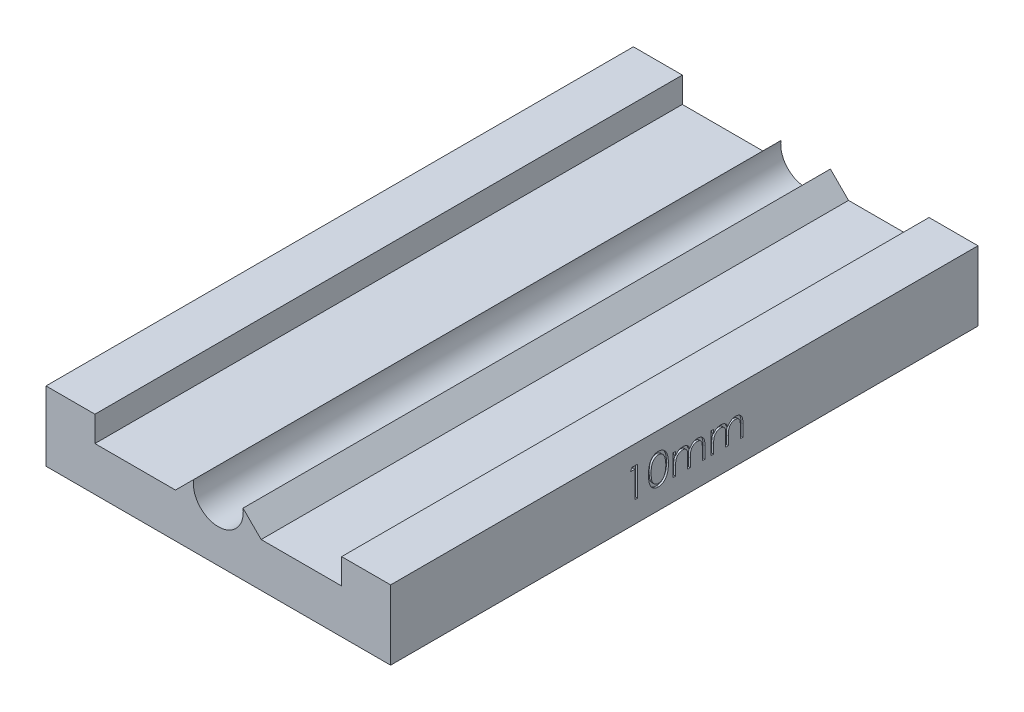
from build123d import *

# Parameters (mm, degrees)
BOSS_EXTRUDE1_DEPTH = 120
CUT_EXTRUDE1_DEPTH  = 0.4


with BuildPart() as part:
    # Sketch1 → Boss-Extrude1 (new body)
    with BuildSketch(Plane.XY):
        with BuildLine():
            ThreePointArc((5.1, 0), (-0.358834748, -5.087360575), (-5.04950495, 0.715890882))
            Line((-5.04950495, 0.715890882), (-8.752906664, -2.987510832))
            Line((-8.752906664, -2.987510832), (-25.2, -2.987510832))
            Line((-25.2, -2.987510832), (-25.2, 2.212489168))
            Line((-25.2, 2.212489168), (-35.2, 2.212489168))
            Line((-35.2, 2.212489168), (-35.2, -12))
            Line((-35.2, -12), (35.2, -12))
            Line((35.2, -12), (35.2, 2.212489168))
            Line((35.2, 2.212489168), (25.2, 2.212489168))
            Line((25.2, 2.212489168), (25.2, -2.987510832))
            Line((25.2, -2.987510832), (8.752906664, -2.987510832))
            Line((8.752906664, -2.987510832), (5.04950495, 0.715890882))
            ThreePointArc((5.04950495, 0.715890882), (5.087360575, 0.358834748), (5.1, 0))
        make_face()
    extrude(amount=BOSS_EXTRUDE1_DEPTH)

    # Sketch2 → Cut-Extrude1 (cut)
    # profile 1 of 4: a face of its own
    with BuildSketch(Plane(origin=(35.2, 0, 0), x_dir=(0, 0, -1), z_dir=(1, 0, 0))):
        Polygon((-70.660407827, -1.654928169), (-69.551032827, -1.654928169), (-69.551032827, -7.654928169), (-70.089494366, -7.654928169), (-70.089494366, -2.270312784), (-71.012571289, -2.270312784), align=None)
    # profile 2 of 4: a face of its own
    with BuildSketch(Plane(origin=(35.2, 0, 0), x_dir=(0, 0, -1), z_dir=(1, 0, 0))):
        with BuildLine():
            add(Edge.make_bspline(
                [(-67.320263596, -4.657332015), (-67.31970128, -4.561165065), (-67.318608971, -4.374359377), (-67.306457392, -4.102157134), (-67.286271091, -3.846796638), (-67.258607023, -3.608265668), (-67.224941914, -3.386502643), (-67.18000108, -3.182100202), (-67.128893419, -2.994112305), (-67.069660654, -2.821925936), (-67.002824445, -2.663221303), (-66.930079998, -2.515063815), (-66.84854035, -2.377677645), (-66.762865642, -2.248870004), (-66.669587805, -2.130749385), (-66.571361307, -2.021647678), (-66.464352376, -1.924086391), (-66.352198648, -1.835207015), (-66.233884709, -1.757293635), (-66.112782996, -1.688666084), (-65.988059957, -1.63003774), (-65.859375072, -1.58393985), (-65.727884973, -1.545864112), (-65.593130001, -1.519825916), (-65.454887663, -1.503442645), (-65.361576632, -1.501876357), (-65.314253981, -1.501082015)],
                knots=[0, 0, 0, 0, 1.646270934, 3.197905019, 4.663502075, 6.030701355, 7.308322542, 8.50163776, 9.611534131, 10.641858119, 11.616356847, 12.558055219, 13.465016945, 14.349605745, 15.204443733, 16.039544428, 16.859896111, 17.680448484, 18.487036065, 19.28249412, 20.06191084, 20.843045899, 21.620316918, 22.403196591, 23.190181807, 24, 24, 24, 24], degree=3))
            add(Edge.make_bspline(
                [(-65.314253981, -1.501082015), (-65.266536018, -1.50191827), (-65.171640003, -1.503581317), (-65.031342217, -1.519565218), (-64.894285619, -1.546087144), (-64.761054524, -1.583665957), (-64.630554548, -1.630287117), (-64.50380642, -1.688722175), (-64.380022852, -1.756743091), (-64.26117093, -1.836669737), (-64.145945875, -1.925782211), (-64.037177939, -2.026518215), (-63.93485722, -2.13786059), (-63.837699554, -2.258618071), (-63.748461387, -2.391106788), (-63.66347836, -2.533022405), (-63.587412013, -2.686846745), (-63.51415257, -2.850013261), (-63.450917736, -3.027036676), (-63.393889887, -3.216919123), (-63.347811655, -3.421903443), (-63.309430045, -3.640914149), (-63.279695938, -3.874755549), (-63.25803998, -4.122926376), (-63.246600405, -4.385589902), (-63.244446061, -4.565174787), (-63.24334052, -4.657332015)],
                knots=[0, 0, 0, 0, 0.810914788, 1.612654377, 2.396697861, 3.181598691, 3.963628158, 4.749916497, 5.551656086, 6.361998678, 7.18212741, 8.025565596, 8.878627764, 9.750805457, 10.657531673, 11.591944965, 12.560506719, 13.57287815, 14.630710178, 15.753379473, 16.941251878, 18.199788006, 19.531962791, 20.947069417, 22.433333509, 24, 24, 24, 24], degree=3))
            add(Edge.make_bspline(
                [(-63.24334052, -4.657332015), (-63.244457522, -4.749087286), (-63.246633955, -4.927868689), (-63.257911738, -5.189350361), (-63.280126534, -5.436204149), (-63.307915085, -5.669022085), (-63.34640245, -5.886835146), (-63.393725593, -6.090397058), (-63.446269003, -6.280586895), (-63.51112865, -6.455846572), (-63.582118439, -6.618620954), (-63.659355918, -6.77062178), (-63.742104192, -6.913192567), (-63.832256326, -7.045192133), (-63.928347892, -7.167555545), (-64.032435529, -7.278122898), (-64.141585104, -7.379558336), (-64.257149245, -7.469818269), (-64.377854762, -7.548820791), (-64.501213179, -7.619473106), (-64.629413265, -7.67644344), (-64.759549755, -7.725360654), (-64.893484097, -7.762732857), (-65.031049339, -7.788573752), (-65.171545743, -7.806696921), (-65.266519855, -7.808079458), (-65.314253981, -7.808774323)],
                knots=[0, 0, 0, 0, 1.561518951, 3.042555995, 4.452378317, 5.7783523, 7.031515105, 8.214008947, 9.334062868, 10.386615937, 11.391082383, 12.354592575, 13.286541444, 14.194233754, 15.072674879, 15.931287219, 16.775624067, 17.606195743, 18.42308326, 19.229000347, 20.022332153, 20.807536673, 21.593273796, 22.3848459, 23.188221202, 24, 24, 24, 24], degree=3))
            add(Edge.make_bspline(
                [(-65.314253981, -7.808774323), (-65.361575319, -7.807974856), (-65.454883762, -7.806398464), (-65.593145063, -7.79008921), (-65.727343537, -7.763868348), (-65.858141401, -7.727154169), (-65.986209713, -7.68221445), (-66.109803347, -7.623665278), (-66.230296519, -7.556235445), (-66.347367758, -7.479443294), (-66.458817177, -7.391463266), (-66.565271929, -7.294153057), (-66.664057676, -7.185084352), (-66.75600184, -7.065979341), (-66.843385991, -6.937933783), (-66.923767774, -6.799199429), (-66.998117809, -6.650326382), (-67.066078079, -6.490352821), (-67.126332931, -6.316944373), (-67.179557573, -6.12811721), (-67.221581843, -5.922204691), (-67.257552624, -5.700860633), (-67.286565852, -5.463133895), (-67.306373267, -5.208895419), (-67.318615521, -4.938303632), (-67.319704213, -4.752698304), (-67.320263596, -4.657332015)],
                knots=[0, 0, 0, 0, 0.810891512, 1.598919785, 2.382837074, 3.152667961, 3.926044502, 4.706494248, 5.493654104, 6.291793342, 7.103789334, 7.925228297, 8.761435821, 9.622817696, 10.50288917, 11.416980706, 12.369136599, 13.353924996, 14.394355917, 15.514179734, 16.714354668, 17.994756427, 19.357759367, 20.818452758, 22.365282078, 24, 24, 24, 24], degree=3))
        make_face()
        with BuildLine():
            add(Edge.make_bspline(
                [(-66.781802058, -4.654928169), (-66.781597292, -4.735068795), (-66.78119988, -4.890606015), (-66.770817822, -5.116623034), (-66.756674567, -5.327429312), (-66.738432343, -5.523292517), (-66.711341575, -5.703549682), (-66.680987081, -5.869440567), (-66.644047499, -6.020087259), (-66.600341754, -6.156523506), (-66.550560445, -6.281064766), (-66.496207536, -6.396952564), (-66.437817725, -6.505555883), (-66.37247061, -6.605899212), (-66.30130193, -6.698309779), (-66.2259192, -6.784423206), (-66.143509056, -6.861218031), (-66.02950264, -6.953321211), (-65.878994398, -7.048496869), (-65.689359332, -7.13137588), (-65.49449913, -7.183460091), (-65.362239844, -7.190083672), (-65.296225135, -7.193389707)],
                knots=[0, 0, 0, 0, 1.459021318, 2.831673884, 4.118529203, 5.306027144, 6.411944654, 7.436330062, 8.375795394, 9.233974572, 10.042671642, 10.816086306, 11.563610507, 12.285937304, 12.993564865, 13.685989202, 14.367179055, 15.041617293, 16.353048772, 17.594441528, 18.799311195, 20, 20, 20, 20], degree=3))
            add(Edge.make_bspline(
                [(-65.296225135, -7.193389707), (-65.229783412, -7.190650655), (-65.097037144, -7.185178204), (-64.903093495, -7.132380369), (-64.714813032, -7.052718301), (-64.567261134, -6.958522577), (-64.455005345, -6.86881687), (-64.37457622, -6.792334615), (-64.300755565, -6.706695986), (-64.23074058, -6.614297193), (-64.166525021, -6.513372934), (-64.108131071, -6.404408519), (-64.054845332, -6.287101357), (-64.024486968, -6.205210376), (-64.00896552, -6.16334163)],
                knots=[0, 0, 0, 0, 1.353760809, 2.704726607, 4.075137775, 5.516104923, 6.260822281, 7.007110065, 7.778089737, 8.566572457, 9.372053459, 10.217411131, 11.088608312, 12, 12, 12, 12], degree=3))
            add(Edge.make_bspline(
                [(-64.00896552, -6.16334163), (-63.990876775, -6.109804934), (-63.954148865, -6.001102481), (-63.906814395, -5.832479078), (-63.869536568, -5.655560054), (-63.835999369, -5.471402711), (-63.813108417, -5.278648938), (-63.794683594, -5.077895137), (-63.783830988, -4.868989944), (-63.7824857, -4.727055674), (-63.781802058, -4.654928169)],
                knots=[0, 0, 0, 0, 0.884706709, 1.796334032, 2.740027952, 3.714592787, 4.726048262, 5.777819803, 6.87074269, 8, 8, 8, 8], degree=3))
            add(Edge.make_bspline(
                [(-63.781802058, -4.654928169), (-63.78274524, -4.58281233), (-63.784590304, -4.441738334), (-63.791642855, -4.235135738), (-63.809854697, -4.038905291), (-63.830081757, -3.852201623), (-63.859905565, -3.676058247), (-63.892061805, -3.509000581), (-63.935263884, -3.353098253), (-63.981412069, -3.205910399), (-64.03422989, -3.069109277), (-64.092371149, -2.942057071), (-64.154465593, -2.8241404), (-64.221909433, -2.715682786), (-64.293902033, -2.616198427), (-64.372343546, -2.527681979), (-64.454122471, -2.447390034), (-64.568666218, -2.355739915), (-64.718622143, -2.262291294), (-64.905214681, -2.176292849), (-65.099392929, -2.126907205), (-65.230661707, -2.119944312), (-65.296225135, -2.11646663)],
                knots=[0, 0, 0, 0, 1.31362396, 2.569729283, 3.763502607, 4.902122613, 5.988968491, 7.01645872, 7.998833611, 8.933434873, 9.825090667, 10.667526885, 11.477055099, 12.250526234, 12.991942729, 13.710640831, 14.402115721, 15.076753259, 16.378508321, 17.609869233, 18.806226677, 20, 20, 20, 20], degree=3))
            add(Edge.make_bspline(
                [(-65.296225135, -2.11646663), (-65.36258615, -2.11994911), (-65.495429074, -2.126920415), (-65.691625568, -2.176108849), (-65.87969017, -2.261845362), (-66.029249556, -2.356049429), (-66.14387319, -2.445772249), (-66.224586378, -2.523577599), (-66.300265531, -2.608685463), (-66.369981588, -2.701945889), (-66.435277502, -2.802172233), (-66.495244952, -2.910152972), (-66.54927466, -3.026435311), (-66.599133865, -3.150920629), (-66.64297293, -3.287345105), (-66.67913401, -3.437806237), (-66.712540387, -3.60316948), (-66.736189419, -3.784402922), (-66.757213001, -3.980315185), (-66.770723883, -4.191647731), (-66.78123461, -4.418043811), (-66.78160912, -4.574385226), (-66.781802058, -4.654928169)],
                knots=[0, 0, 0, 0, 1.207732386, 2.417664972, 3.655092373, 4.956220595, 5.625982001, 6.301752483, 6.994047911, 7.697131622, 8.419323945, 9.170223765, 9.943494443, 10.752040957, 11.610060368, 12.549350801, 13.567764191, 14.679664412, 15.874934091, 17.154273443, 18.533957287, 20, 20, 20, 20], degree=3))
        make_face(mode=Mode.SUBTRACT)
    # profile 3 of 4: a face of its own
    with BuildSketch(Plane(origin=(35.2, 0, 0), x_dir=(0, 0, -1), z_dir=(1, 0, 0))):
        with BuildLine():
            Line((-62.320263596, -3.270312784), (-61.781802058, -3.270312784))
            Line((-61.781802058, -3.270312784), (-61.781802058, -4.032332015))
            add(Edge.make_bspline(
                [(-61.781802058, -4.032332015), (-61.733315287, -3.965667555), (-61.640409985, -3.837932058), (-61.488068866, -3.669605857), (-61.335881245, -3.526757592), (-61.226281162, -3.451769812), (-61.173628981, -3.415745477)],
                knots=[0, 0, 0, 0, 1.134379233, 2.173579362, 3.122582517, 4, 4, 4, 4], degree=3))
            add(Edge.make_bspline(
                [(-61.173628981, -3.415745477), (-61.101860989, -3.381450565), (-60.959578875, -3.313459913), (-60.734288775, -3.244488098), (-60.50376077, -3.20210221), (-60.348089546, -3.19630557), (-60.269782827, -3.193389707)],
                knots=[0, 0, 0, 0, 1.014936303, 2.012140481, 3.000054389, 4, 4, 4, 4], degree=3))
            add(Edge.make_bspline(
                [(-60.269782827, -3.193389707), (-60.216823405, -3.195181634), (-60.112019555, -3.198727762), (-59.956732543, -3.221802108), (-59.80611778, -3.261686976), (-59.661065158, -3.317242388), (-59.524401137, -3.384522423), (-59.399105369, -3.463464779), (-59.286606726, -3.552088337), (-59.186962067, -3.654395079), (-59.097358024, -3.77325782), (-59.014937144, -3.911882246), (-58.938779637, -4.073381094), (-58.896571679, -4.190580879), (-58.874350135, -4.252283938)],
                knots=[0, 0, 0, 0, 1.009824226, 1.998387844, 2.986035974, 3.974953746, 4.955485308, 5.885931332, 6.793869504, 7.679848016, 8.601185859, 9.625726857, 10.749998409, 12, 12, 12, 12], degree=3))
            add(Edge.make_bspline(
                [(-58.874350135, -4.252283938), (-58.850845133, -4.209899219), (-58.804590589, -4.126492045), (-58.726923783, -4.00844931), (-58.645550417, -3.898037667), (-58.559777, -3.795169511), (-58.46990628, -3.70035283), (-58.375515308, -3.613274141), (-58.277141397, -3.533559489), (-58.1403547, -3.440434073), (-57.96239023, -3.341517762), (-57.738010605, -3.255754715), (-57.504610311, -3.202755638), (-57.346179971, -3.196532313), (-57.266177058, -3.193389707)],
                knots=[0, 0, 0, 0, 0.86119277, 1.694706429, 2.50939023, 3.298075842, 4.073795165, 4.829715201, 5.57930267, 6.321991688, 7.768977793, 9.186738141, 10.579381044, 12, 12, 12, 12], degree=3))
            add(Edge.make_bspline(
                [(-57.266177058, -3.193389707), (-57.192665979, -3.196162086), (-57.04879766, -3.2015879), (-56.839350918, -3.244193854), (-56.644022109, -3.317355535), (-56.463204264, -3.417184626), (-56.300073156, -3.542634655), (-56.158273769, -3.691895519), (-56.038667431, -3.863911445), (-55.96053262, -4.025726282), (-55.907535025, -4.168586853), (-55.874858623, -4.290311924), (-55.845990574, -4.424286014), (-55.822022725, -4.57066932), (-55.804505207, -4.729978934), (-55.791526838, -4.90195415), (-55.782742712, -5.086728627), (-55.782122017, -5.214212342), (-55.781802058, -5.279928169)],
                knots=[0, 0, 0, 0, 1.209669288, 2.367440248, 3.500751976, 4.631527125, 5.755587489, 6.87532382, 8.007944318, 9.190864318, 9.82315674, 10.514484317, 11.263564316, 12.079023757, 12.955305781, 13.901327259, 14.918167583, 16, 16, 16, 16], degree=3))
            Line((-55.781802058, -5.279928169), (-55.781802058, -7.654928169))
            Line((-55.781802058, -7.654928169), (-56.320263596, -7.654928169))
            Line((-56.320263596, -7.654928169), (-56.320263596, -5.277524323))
            add(Edge.make_bspline(
                [(-56.320263596, -5.277524323), (-56.32039711, -5.22143191), (-56.320653703, -5.113630824), (-56.325271357, -4.958912336), (-56.333971896, -4.817880867), (-56.344145562, -4.690728716), (-56.358277807, -4.577159364), (-56.376527975, -4.477400932), (-56.395861141, -4.390668684), (-56.427979983, -4.294521174), (-56.479319226, -4.188457956), (-56.55752062, -4.074074683), (-56.656040802, -3.974507597), (-56.76980107, -3.888076197), (-56.89931269, -3.817801384), (-57.042052215, -3.767613938), (-57.197133447, -3.736546147), (-57.304486798, -3.73345012), (-57.359927058, -3.731851246)],
                knots=[0, 0, 0, 0, 1.253487763, 2.409012846, 3.458416907, 4.410876679, 5.259312806, 6.014470957, 6.676830364, 7.243083969, 8.276244668, 9.299465089, 10.325150304, 11.392391894, 12.482080715, 13.603491619, 14.762376348, 16, 16, 16, 16], degree=3))
            add(Edge.make_bspline(
                [(-57.359927058, -3.731851246), (-57.427932694, -3.734278944), (-57.562337685, -3.739076999), (-57.758529947, -3.788060781), (-57.947051689, -3.86191264), (-58.122277632, -3.968939709), (-58.28346813, -4.097182618), (-58.42215312, -4.24966764), (-58.536722581, -4.422176086), (-58.614300826, -4.581856147), (-58.663311057, -4.725289479), (-58.695671484, -4.85059926), (-58.720843012, -4.993024805), (-58.744449633, -5.151609075), (-58.759857167, -5.32744367), (-58.773860091, -5.519715214), (-58.780410142, -5.729002002), (-58.781326357, -5.874076325), (-58.781802058, -5.949399323)],
                knots=[0, 0, 0, 0, 1.090531906, 2.155305635, 3.229839962, 4.33261226, 5.44038871, 6.529323825, 7.629011124, 8.757537029, 9.370236727, 10.061839251, 10.834451254, 11.692844982, 12.636905849, 13.66920014, 14.789842145, 16, 16, 16, 16], degree=3))
            Line((-58.781802058, -5.949399323), (-58.781802058, -7.654928169))
            Line((-58.781802058, -7.654928169), (-59.320263596, -7.654928169))
            Line((-59.320263596, -7.654928169), (-59.320263596, -5.425360861))
            add(Edge.make_bspline(
                [(-59.320263596, -5.425360861), (-59.320399764, -5.362458029), (-59.320661736, -5.241439302), (-59.325249709, -5.067895859), (-59.333969632, -4.910042579), (-59.344050572, -4.768062927), (-59.358553735, -4.642214934), (-59.375027613, -4.531823921), (-59.394482374, -4.437166633), (-59.426693604, -4.333343688), (-59.475918407, -4.218964963), (-59.555098285, -4.097008926), (-59.653854137, -3.990263616), (-59.769689924, -3.899134333), (-59.899985379, -3.82380608), (-60.043956924, -3.769532219), (-60.200308203, -3.737947723), (-60.308098556, -3.733921728), (-60.363532827, -3.731851246)],
                knots=[0, 0, 0, 0, 1.320475261, 2.540461679, 3.643808994, 4.639130445, 5.527981419, 6.302341397, 6.981980563, 7.553956391, 8.582137848, 9.585246428, 10.591171744, 11.620968678, 12.668337649, 13.738356861, 14.836885341, 16, 16, 16, 16], degree=3))
            add(Edge.make_bspline(
                [(-60.363532827, -3.731851246), (-60.428703475, -3.734474892), (-60.558586263, -3.739703724), (-60.74938964, -3.786768194), (-60.933650811, -3.860489465), (-61.108430295, -3.96276344), (-61.269014549, -4.089447575), (-61.40960015, -4.238444539), (-61.527787337, -4.407900025), (-61.606184734, -4.565896339), (-61.656753547, -4.705736239), (-61.690345549, -4.824623578), (-61.719213479, -4.956624004), (-61.740666088, -5.102144766), (-61.761375372, -5.26023807), (-61.771370187, -5.431691481), (-61.781092865, -5.616357917), (-61.781559862, -5.743853709), (-61.781802058, -5.809976246)],
                knots=[0, 0, 0, 0, 1.098833095, 2.189935336, 3.297829714, 4.440610912, 5.596351641, 6.740013378, 7.886572111, 9.072425424, 9.705826452, 10.395263256, 11.156850408, 11.985370555, 12.878090359, 13.847760091, 14.883794034, 16, 16, 16, 16], degree=3))
            Line((-61.781802058, -5.809976246), (-61.781802058, -7.654928169))
            Line((-61.781802058, -7.654928169), (-62.320263596, -7.654928169))
            Line((-62.320263596, -7.654928169), (-62.320263596, -3.270312784))
        make_face()
    # profile 4 of 4: a face of its own
    with BuildSketch(Plane(origin=(35.2, 0, 0), x_dir=(0, 0, -1), z_dir=(1, 0, 0))):
        with BuildLine():
            Line((-54.551032827, -3.270312784), (-54.012571289, -3.270312784))
            Line((-54.012571289, -3.270312784), (-54.012571289, -4.032332015))
            add(Edge.make_bspline(
                [(-54.012571289, -4.032332015), (-53.964084517, -3.965667555), (-53.871179215, -3.837932058), (-53.718838097, -3.669605857), (-53.566650475, -3.526757592), (-53.457050392, -3.451769812), (-53.404398212, -3.415745477)],
                knots=[0, 0, 0, 0, 1.134379233, 2.173579362, 3.122582517, 4, 4, 4, 4], degree=3))
            add(Edge.make_bspline(
                [(-53.404398212, -3.415745477), (-53.33263022, -3.381450565), (-53.190348106, -3.313459913), (-52.965058006, -3.244488098), (-52.734530001, -3.20210221), (-52.578858777, -3.19630557), (-52.500552058, -3.193389707)],
                knots=[0, 0, 0, 0, 1.014936303, 2.012140481, 3.000054389, 4, 4, 4, 4], degree=3))
            add(Edge.make_bspline(
                [(-52.500552058, -3.193389707), (-52.447592635, -3.195181634), (-52.342788786, -3.198727762), (-52.187501774, -3.221802108), (-52.036887011, -3.261686976), (-51.891834389, -3.317242388), (-51.755170367, -3.384522423), (-51.6298746, -3.463464779), (-51.517375957, -3.552088337), (-51.417731298, -3.654395079), (-51.328127254, -3.77325782), (-51.245706374, -3.911882246), (-51.169548867, -4.073381094), (-51.127340909, -4.190580879), (-51.105119366, -4.252283938)],
                knots=[0, 0, 0, 0, 1.009824226, 1.998387844, 2.986035974, 3.974953746, 4.955485308, 5.885931332, 6.793869504, 7.679848016, 8.601185859, 9.625726857, 10.749998409, 12, 12, 12, 12], degree=3))
            add(Edge.make_bspline(
                [(-51.105119366, -4.252283938), (-51.081614363, -4.209899219), (-51.03535982, -4.126492045), (-50.957693013, -4.00844931), (-50.876319648, -3.898037667), (-50.790546231, -3.795169511), (-50.700675511, -3.70035283), (-50.606284539, -3.613274141), (-50.507910628, -3.533559489), (-50.371123931, -3.440434073), (-50.193159461, -3.341517762), (-49.968779836, -3.255754715), (-49.735379542, -3.202755638), (-49.576949202, -3.196532313), (-49.496946289, -3.193389707)],
                knots=[0, 0, 0, 0, 0.86119277, 1.694706429, 2.50939023, 3.298075842, 4.073795165, 4.829715201, 5.57930267, 6.321991688, 7.768977793, 9.186738141, 10.579381044, 12, 12, 12, 12], degree=3))
            add(Edge.make_bspline(
                [(-49.496946289, -3.193389707), (-49.42343521, -3.196162086), (-49.27956689, -3.2015879), (-49.070120149, -3.244193854), (-48.87479134, -3.317355535), (-48.693973495, -3.417184626), (-48.530842386, -3.542634655), (-48.389042999, -3.691895519), (-48.269436662, -3.863911445), (-48.191301851, -4.025726282), (-48.138304255, -4.168586853), (-48.105627854, -4.290311924), (-48.076759805, -4.424286014), (-48.052791956, -4.57066932), (-48.035274438, -4.729978934), (-48.022296069, -4.90195415), (-48.013511943, -5.086728627), (-48.012891247, -5.214212342), (-48.012571289, -5.279928169)],
                knots=[0, 0, 0, 0, 1.209669288, 2.367440248, 3.500751976, 4.631527125, 5.755587489, 6.87532382, 8.007944318, 9.190864318, 9.82315674, 10.514484317, 11.263564316, 12.079023757, 12.955305781, 13.901327259, 14.918167583, 16, 16, 16, 16], degree=3))
            Line((-48.012571289, -5.279928169), (-48.012571289, -7.654928169))
            Line((-48.012571289, -7.654928169), (-48.551032827, -7.654928169))
            Line((-48.551032827, -7.654928169), (-48.551032827, -5.277524323))
            add(Edge.make_bspline(
                [(-48.551032827, -5.277524323), (-48.551166341, -5.22143191), (-48.551422934, -5.113630824), (-48.556040588, -4.958912336), (-48.564741126, -4.817880867), (-48.574914793, -4.690728716), (-48.589047037, -4.577159364), (-48.607297206, -4.477400932), (-48.626630372, -4.390668684), (-48.658749214, -4.294521174), (-48.710088456, -4.188457956), (-48.788289851, -4.074074683), (-48.886810033, -3.974507597), (-49.000570301, -3.888076197), (-49.130081921, -3.817801384), (-49.272821446, -3.767613938), (-49.427902677, -3.736546147), (-49.535256029, -3.73345012), (-49.590696289, -3.731851246)],
                knots=[0, 0, 0, 0, 1.253487763, 2.409012846, 3.458416907, 4.410876679, 5.259312806, 6.014470957, 6.676830364, 7.243083969, 8.276244668, 9.299465089, 10.325150304, 11.392391894, 12.482080715, 13.603491619, 14.762376348, 16, 16, 16, 16], degree=3))
            add(Edge.make_bspline(
                [(-49.590696289, -3.731851246), (-49.658701925, -3.734278944), (-49.793106915, -3.739076999), (-49.989299177, -3.788060781), (-50.17782092, -3.86191264), (-50.353046862, -3.968939709), (-50.514237361, -4.097182618), (-50.652922351, -4.24966764), (-50.767491812, -4.422176086), (-50.845070057, -4.581856147), (-50.894080287, -4.725289479), (-50.926440714, -4.85059926), (-50.951612243, -4.993024805), (-50.975218864, -5.151609075), (-50.990626398, -5.32744367), (-51.004629322, -5.519715214), (-51.011179372, -5.729002002), (-51.012095587, -5.874076325), (-51.012571289, -5.949399323)],
                knots=[0, 0, 0, 0, 1.090531906, 2.155305635, 3.229839962, 4.33261226, 5.44038871, 6.529323825, 7.629011124, 8.757537029, 9.370236727, 10.061839251, 10.834451254, 11.692844982, 12.636905849, 13.66920014, 14.789842145, 16, 16, 16, 16], degree=3))
            Line((-51.012571289, -5.949399323), (-51.012571289, -7.654928169))
            Line((-51.012571289, -7.654928169), (-51.551032827, -7.654928169))
            Line((-51.551032827, -7.654928169), (-51.551032827, -5.425360861))
            add(Edge.make_bspline(
                [(-51.551032827, -5.425360861), (-51.551168995, -5.362458029), (-51.551430967, -5.241439302), (-51.55601894, -5.067895859), (-51.564738862, -4.910042579), (-51.574819802, -4.768062927), (-51.589322966, -4.642214934), (-51.605796844, -4.531823921), (-51.625251604, -4.437166633), (-51.657462835, -4.333343688), (-51.706687638, -4.218964963), (-51.785867516, -4.097008926), (-51.884623368, -3.990263616), (-52.000459155, -3.899134333), (-52.13075461, -3.82380608), (-52.274726154, -3.769532219), (-52.431077434, -3.737947723), (-52.538867787, -3.733921728), (-52.594302058, -3.731851246)],
                knots=[0, 0, 0, 0, 1.320475261, 2.540461679, 3.643808994, 4.639130445, 5.527981419, 6.302341397, 6.981980563, 7.553956391, 8.582137848, 9.585246428, 10.591171744, 11.620968678, 12.668337649, 13.738356861, 14.836885341, 16, 16, 16, 16], degree=3))
            add(Edge.make_bspline(
                [(-52.594302058, -3.731851246), (-52.659472706, -3.734474892), (-52.789355494, -3.739703724), (-52.98015887, -3.786768194), (-53.164420042, -3.860489465), (-53.339199526, -3.96276344), (-53.49978378, -4.089447575), (-53.640369381, -4.238444539), (-53.758556568, -4.407900025), (-53.836953965, -4.565896339), (-53.887522778, -4.705736239), (-53.92111478, -4.824623578), (-53.94998271, -4.956624004), (-53.971435318, -5.102144766), (-53.992144602, -5.26023807), (-54.002139418, -5.431691481), (-54.011862096, -5.616357917), (-54.012329093, -5.743853709), (-54.012571289, -5.809976246)],
                knots=[0, 0, 0, 0, 1.098833095, 2.189935336, 3.297829714, 4.440610912, 5.596351641, 6.740013378, 7.886572111, 9.072425424, 9.705826452, 10.395263256, 11.156850408, 11.985370555, 12.878090359, 13.847760091, 14.883794034, 16, 16, 16, 16], degree=3))
            Line((-54.012571289, -5.809976246), (-54.012571289, -7.654928169))
            Line((-54.012571289, -7.654928169), (-54.551032827, -7.654928169))
            Line((-54.551032827, -7.654928169), (-54.551032827, -3.270312784))
        make_face()
    extrude(amount=-CUT_EXTRUDE1_DEPTH, mode=Mode.SUBTRACT)


solid = part.part
